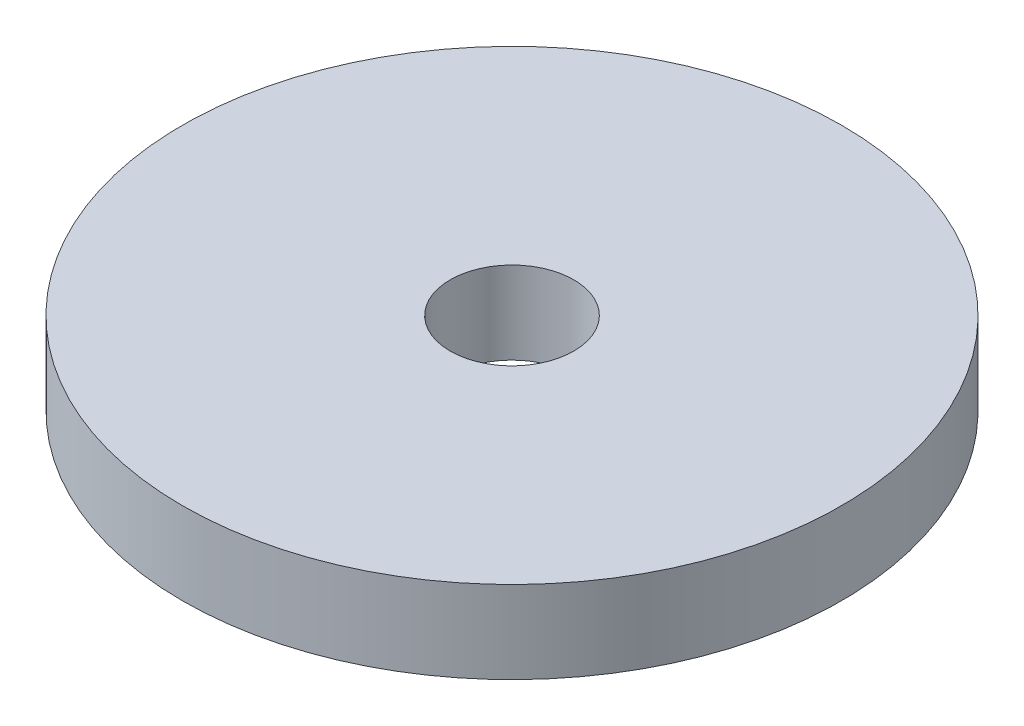
from build123d import *

# Parameters (mm, degrees)
SKETCH1_R           = 12.7
SKETCH1_R_2         = 2.38125
BOSS_EXTRUDE1_DEPTH = 3.175


with BuildPart() as part:
    # Sketch1 → Boss-Extrude1 (new body)
    with BuildSketch(Plane(origin=(0, 0, 0), x_dir=(1, 0, 0), z_dir=(0, 1, 0))):
        with Locations(Location((0, 0, 0), (0, 0, 270))):
            Circle(SKETCH1_R)
        with Locations(Location((0, 0, 0), (0, 0, 270))):
            Circle(SKETCH1_R_2, mode=Mode.SUBTRACT)
    extrude(amount=BOSS_EXTRUDE1_DEPTH)


solid = part.part
